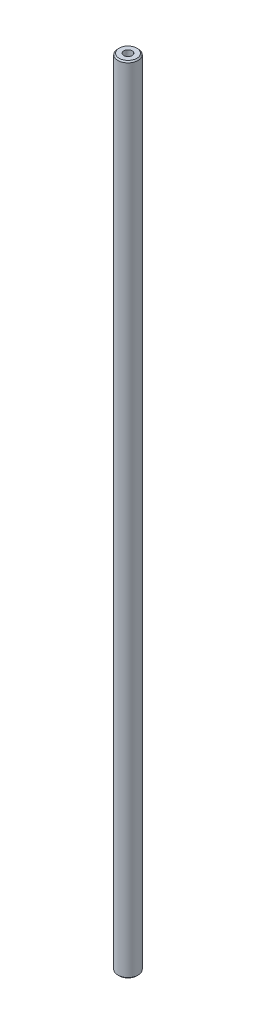
from build123d import *

# Parameters (mm, degrees)
SKETCH1_R           = 4
BOSS_EXTRUDE1_DEPTH = 157.5
CHAMFER1_SIZE       = 0.5
SKETCH2_R           = 1.65
CUT_EXTRUDE1_DEPTH  = 12
CUT_EXTRUDE2_START  = -12
SKETCH3_R           = 1.65
CUT_EXTRUDE2_DEPTH  = 12


with BuildPart() as part:
    # Sketch1 → Boss-Extrude1 (new, symmetric)
    with BuildSketch(Plane(origin=(0, 0, 0), x_dir=(1, 0, 0), z_dir=(0, 1, 0))):
        with Locations(Location((0, 0, 0), (0, 0, 270))):
            Circle(SKETCH1_R)
    extrude(amount=BOSS_EXTRUDE1_DEPTH, both=True)

    # Chamfer1
    chamfer1_edges = [part.edges().sort_by_distance(p)[0] for p in [
        (0, -157.5, -4),
        (0, 157.5, -4),
    ]]
    chamfer(chamfer1_edges, length=CHAMFER1_SIZE)

    # Sketch2 → Cut-Extrude1 (cut)
    with BuildSketch(Plane(origin=(0, 157.5, 0), x_dir=(1, 0, 0), z_dir=(0, 1, 0))):
        with Locations(Location((0, 0, 0), (0, 0, 270))):
            Circle(SKETCH2_R)
    extrude(amount=-CUT_EXTRUDE1_DEPTH, mode=Mode.SUBTRACT)

    # Sketch3 → Cut-Extrude2 (cut)
    with BuildSketch(Plane.XZ.offset(157.5).offset(CUT_EXTRUDE2_START)):
        with Locations(Location((0, 0, 0), (0, 0, 90))):
            Circle(SKETCH3_R)
    extrude(amount=CUT_EXTRUDE2_DEPTH, mode=Mode.SUBTRACT)


solid = part.part
